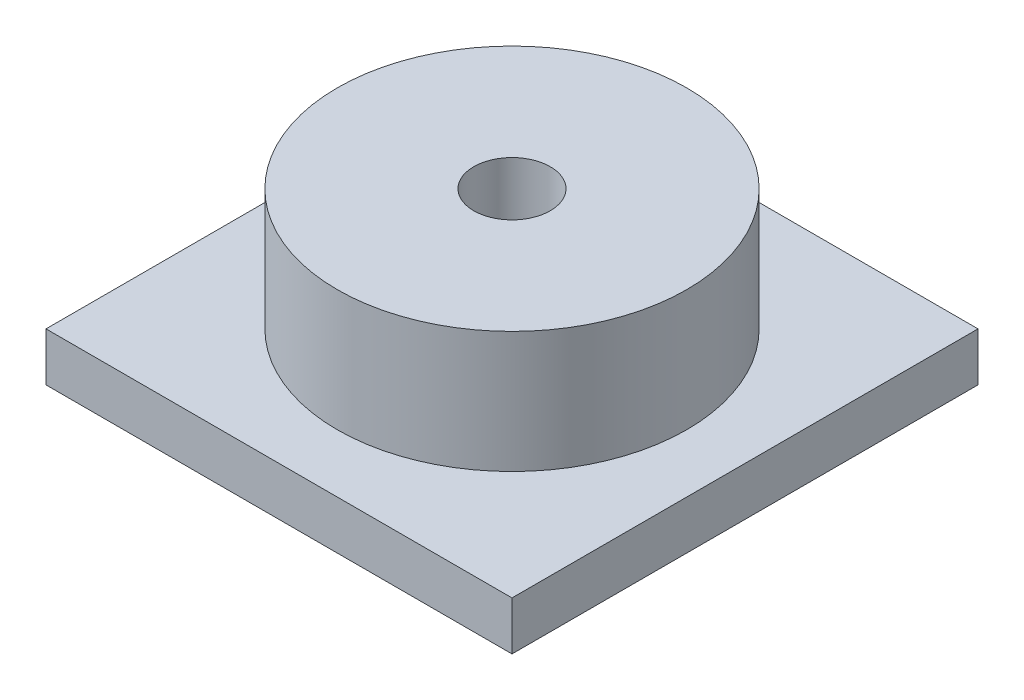
from build123d import *

# Parameters (mm, degrees)
SKETCH1_W           = 24.384
SKETCH1_H           = 24.384
BOSS_EXTRUDE1_DEPTH = 2.54
SKETCH2_R           = 9.144
BOSS_EXTRUDE2_DEPTH = 6.35
SKETCH3_R           = 2
CUT_EXTRUDE1_DEPTH  = 36.611669604


with BuildPart() as part:
    # Sketch1 → Boss-Extrude1 (new body)
    with BuildSketch(Plane(origin=(0, 0, 0), x_dir=(1, 0, 0), z_dir=(0, 1, 0))):
        with Locations((12.192, -12.192)):
            Rectangle(SKETCH1_W, SKETCH1_H)
    extrude(amount=BOSS_EXTRUDE1_DEPTH)

    # Sketch2 → Boss-Extrude2 (add)
    with BuildSketch(Plane(origin=(0, 2.54, 0), x_dir=(1, 0, 0), z_dir=(0, 1, 0))):
        with Locations(Location((12.192, -12.192, 0), (0, 0, 270))):
            Circle(SKETCH2_R)
    extrude(amount=BOSS_EXTRUDE2_DEPTH)

    # Sketch3 → Cut-Extrude1 (cut, through all)
    with BuildSketch(Plane(origin=(0, 8.89, 0), x_dir=(1, 0, 0), z_dir=(0, 1, 0))):
        with Locations(Location((12.192, -12.192, 0), (0, 0, 270))):
            Circle(SKETCH3_R)
    extrude(amount=-CUT_EXTRUDE1_DEPTH, mode=Mode.SUBTRACT)


solid = part.part
